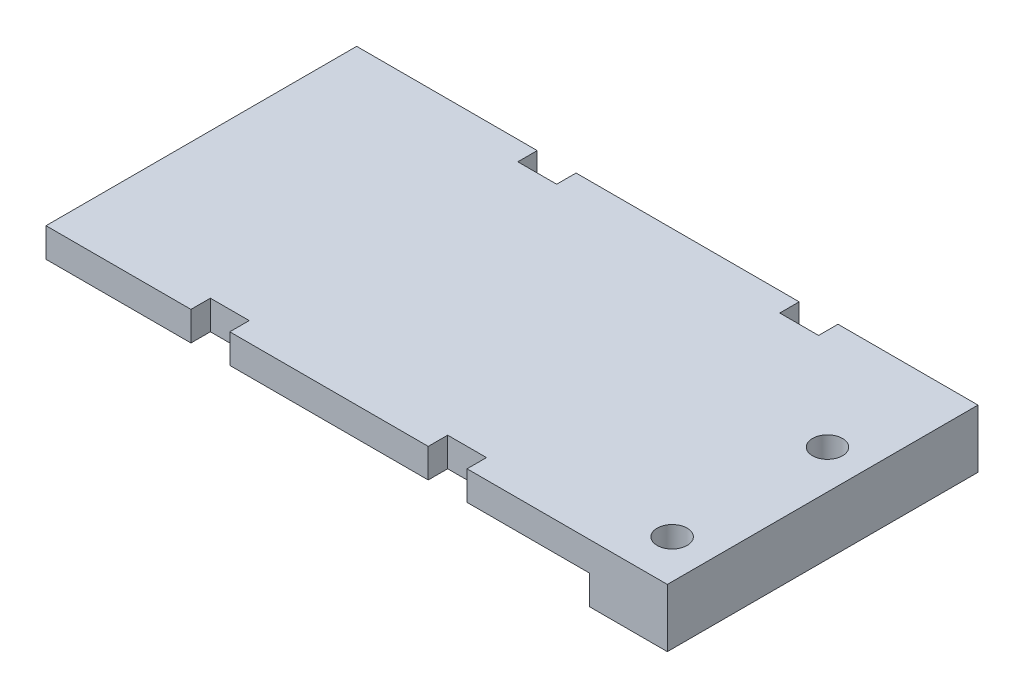
from build123d import *

# Parameters (mm, degrees)
SKETCH1_W                    = 101.6
SKETCH1_H                    = 50.8
BOSS_EXTRUDE1_DEPTH          = 4.7625
SKETCH3_W                    = 12.7
SKETCH3_H                    = 50.8
BOSS_EXTRUDE2_DEPTH          = 4.7625
F_10_0_1935_DIAMETER_HOLE1_D = 4.9149
SKETCH9_W                    = 6.35
SKETCH9_H                    = 3.175
CUT_EXTRUDE1_DEPTH           = 58.589283942


with BuildPart() as part:
    # Sketch1 → Boss-Extrude1 (new body)
    with BuildSketch(Plane(origin=(0, 0, 0), x_dir=(1, 0, 0), z_dir=(0, 1, 0))):
        Rectangle(SKETCH1_W, SKETCH1_H)
    extrude(amount=BOSS_EXTRUDE1_DEPTH)

    # Sketch3 → Boss-Extrude2 (add)
    with BuildSketch(Plane.XZ):
        with Locations((44.45, 0)):
            Rectangle(SKETCH3_W, SKETCH3_H)
    extrude(amount=BOSS_EXTRUDE2_DEPTH)

    # #10 (0.1935) Diameter Hole1 (through all)
    with Locations(Plane(origin=(0, 4.7625, 0), x_dir=(1, 0, 0), z_dir=(0, 1, 0))):
        with Locations((44.45, 7.139305), (44.45, -18.260695)):
            Hole(F_10_0_1935_DIAMETER_HOLE1_D / 2)

    # Sketch9 → Cut-Extrude1 (cut, through all)
    with BuildSketch(Plane(origin=(0, 4.7625, 0), x_dir=(1, 0, 0), z_dir=(0, 1, 0))):
        with Locations((24.731908969, 23.8125)):
            Rectangle(SKETCH9_W, SKETCH9_H)
        with Locations((-18.099171267, 23.8125)):
            Rectangle(SKETCH9_W, SKETCH9_H)
        with Locations((-23.921416816, -23.8125)):
            Rectangle(SKETCH9_W, SKETCH9_H)
        with Locations((14.878103248, -23.8125)):
            Rectangle(SKETCH9_W, SKETCH9_H)
    extrude(amount=-CUT_EXTRUDE1_DEPTH, mode=Mode.SUBTRACT)


solid = part.part
